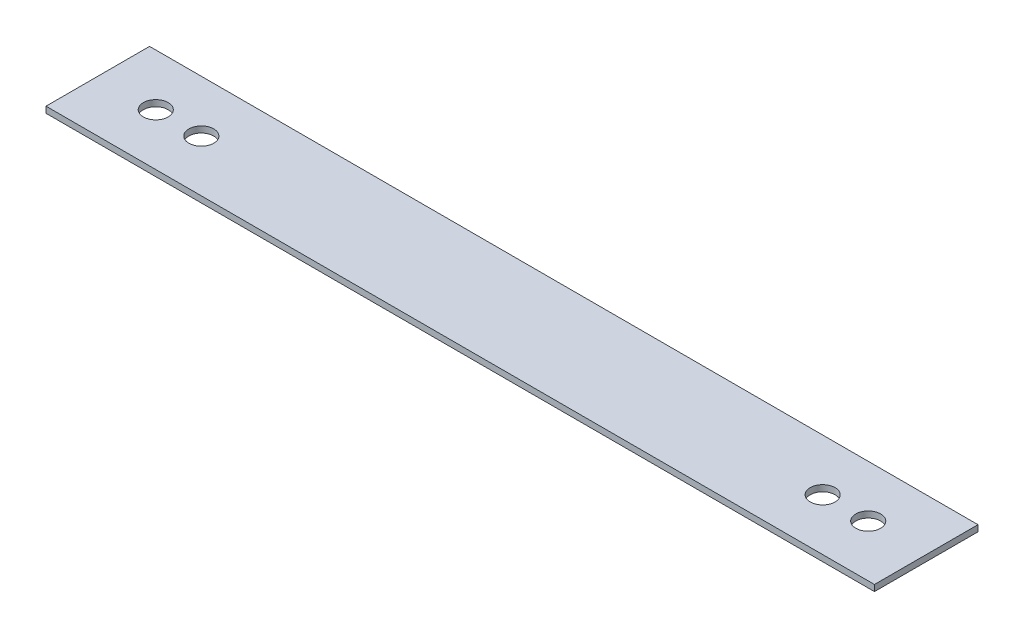
from build123d import *

# Parameters (mm, degrees)
SKETCH_1_W          = 400
SKETCH_1_H          = 50
EXTRUDE_1_DEPTH     = 3
SKETCH_2_R          = 6
CUT_EXTRUDE_1_DEPTH = 8


with BuildPart() as part:
    # 草图1 → 凸台-拉伸1 (new body)
    with BuildSketch(Plane(origin=(0, 0, 0), x_dir=(1, 0, 0), z_dir=(0, 1, 0))):
        Rectangle(SKETCH_1_W, SKETCH_1_H)
    extrude(amount=EXTRUDE_1_DEPTH)

    # 草图2 → 切除-拉伸1 (cut)
    with BuildSketch(Plane(origin=(0, 3, 0), x_dir=(1, 0, 0), z_dir=(0, 1, 0))):
        with Locations(Location((-172, 0, 0), (0, 0, 270))):
            Circle(SKETCH_2_R)
        with Locations(Location((-150, 0, 0), (0, 0, 270))):
            Circle(SKETCH_2_R)
        with Locations(Location((150, 0, 0), (0, 0, 270))):
            Circle(SKETCH_2_R)
        with Locations(Location((172, 0, 0), (0, 0, 270))):
            Circle(SKETCH_2_R)
    extrude(amount=-CUT_EXTRUDE_1_DEPTH, mode=Mode.SUBTRACT)


solid = part.part
